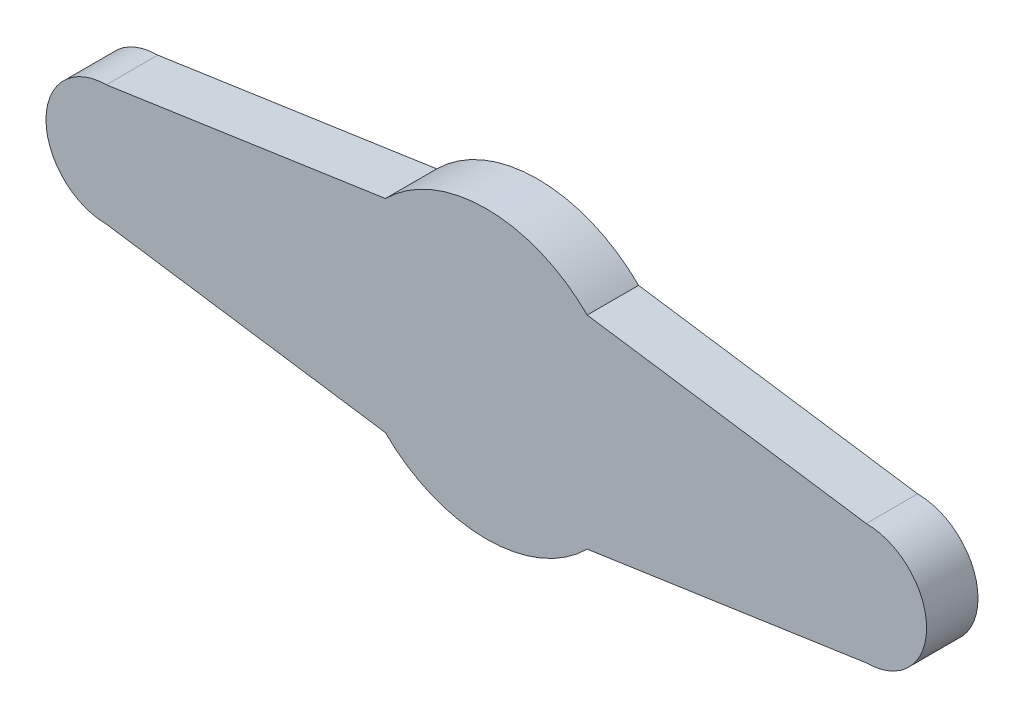
from build123d import *

# Parameters (mm, degrees)
BOSS_EXTRUDE1_DEPTH = 2.3


with BuildPart() as part:
    # Sketch1 → Boss-Extrude1 (new body)
    with BuildSketch(Plane.XY):
        with BuildLine():
            ThreePointArc((-17, 2.7), (-19.7, 0), (-17, -2.7))
            Line((-17, -2.7), (-4.514897629, -4.536044466))
            ThreePointArc((-4.514897629, -4.536044466), (0, -6.4), (4.514897629, -4.536044466))
            Line((4.514897629, -4.536044466), (17, -2.7))
            ThreePointArc((17, -2.7), (19.7, 0), (17, 2.7))
            Line((17, 2.7), (4.514897629, 4.536044466))
            ThreePointArc((4.514897629, 4.536044466), (0, 6.4), (-4.514897629, 4.536044466))
            Line((-4.514897629, 4.536044466), (-17, 2.7))
        make_face()
    extrude(amount=BOSS_EXTRUDE1_DEPTH)


solid = part.part
